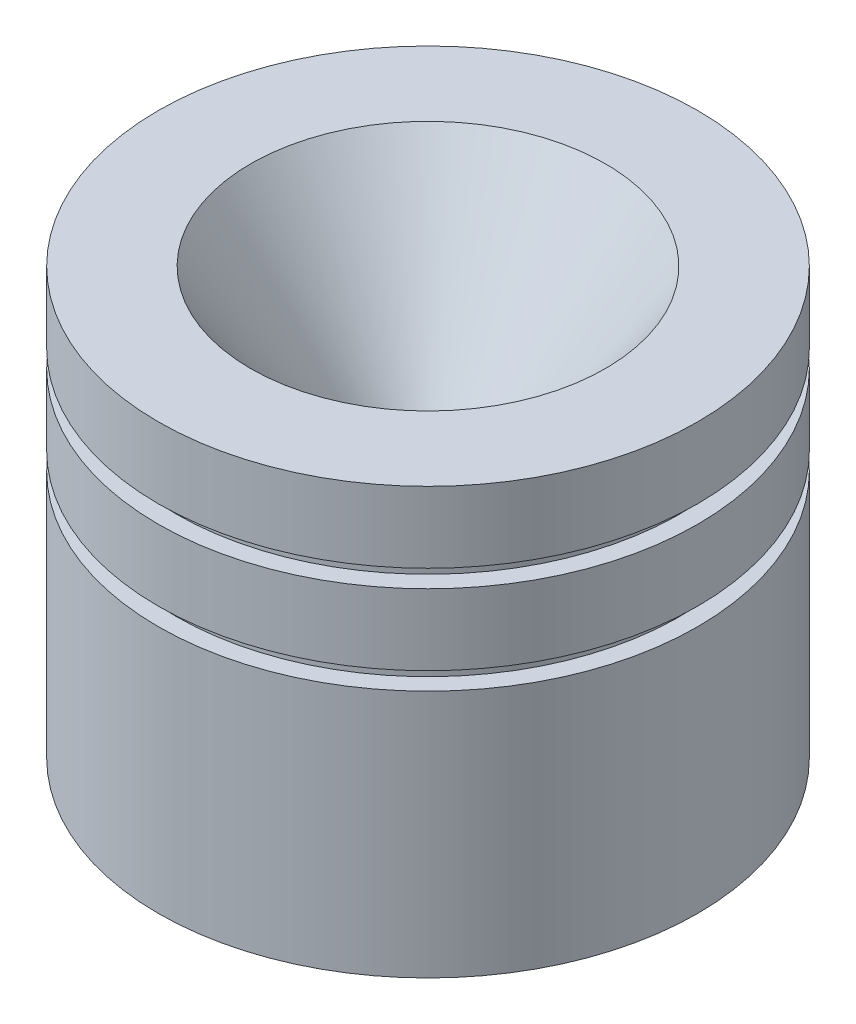
from build123d import *

# Parameters (mm, degrees)
FILLET1_R   = 2.54
SKETCH3_W   = 20.447112079
SKETCH3_H   = 3.175
SKETCH3_W_2 = 12.7


with BuildPart() as part:
    # Sketch2 → Revolve1 (revolve)
    with BuildSketch(Plane.XY, mode=Mode.PRIVATE) as revolve1_sk:
        Polygon((48.26, 0), (48.26, 76.2), (31.75, 76.2), (6.35, 40.64), (46.99, 0), align=None)
    revolve(revolve1_sk.sketch.rotate(Axis((0, 0, 0), (0, 1, 0)), 90), axis=Axis((0, 0, 0), (0, 1, 0)))

    # Fillet1
    fillet1_edges = [part.edges().sort_by_distance(p)[0] for p in [
        (0, 40.64, 6.35),
    ]]
    fillet(fillet1_edges, radius=FILLET1_R)

    # Sketch3 → Cut-Revolve1 (revolve, cut)
    with BuildSketch(Plane.XY, mode=Mode.PRIVATE) as cut_revolve1_sk:
        with Locations((55.30855604, 61.9125)):
            Rectangle(SKETCH3_W, SKETCH3_H)
        with Locations((51.435, 46.0375)):
            Rectangle(SKETCH3_W_2, SKETCH3_H)
    revolve(cut_revolve1_sk.sketch.rotate(Axis((0, 0, 0), (0, -1, 0)), 90), axis=Axis((0, 0, 0), (0, -1, 0)), mode=Mode.SUBTRACT)


solid = part.part
